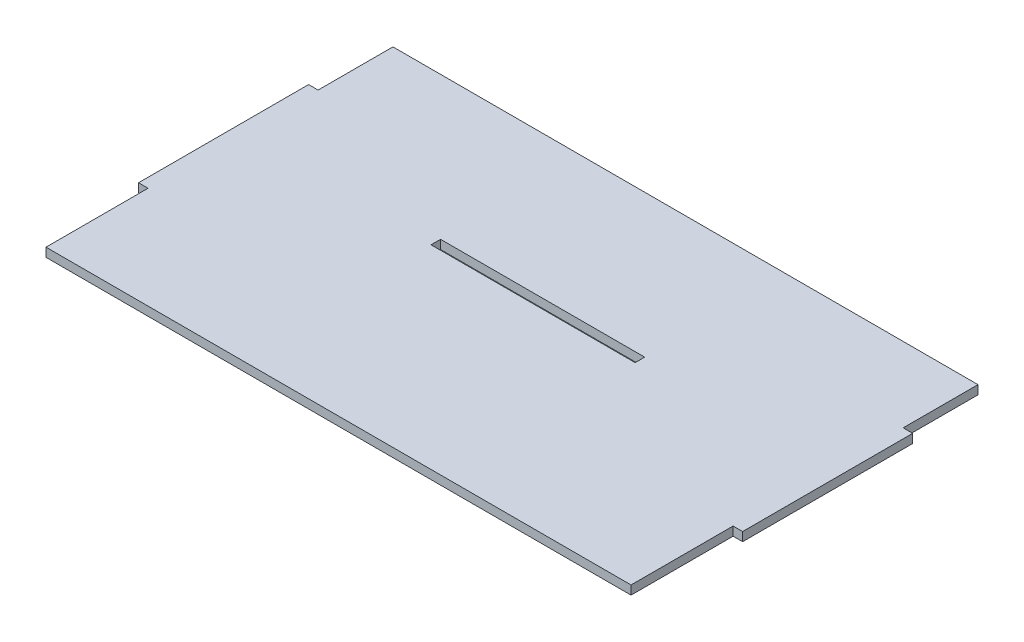
from build123d import *

# Parameters (mm, degrees)
SKETCH1_W           = 86
SKETCH1_H           = 50
BOSS_EXTRUDE1_DEPTH = 1.3
SKETCH2_W           = 1.4
SKETCH2_H           = 25
BOSS_EXTRUDE2_DEPTH = 1.3
SKETCH3_W           = 30
SKETCH3_H           = 1.4
CUT_EXTRUDE1_DEPTH  = 51.971070226
SKETCH4_W           = 86
SKETCH4_H           = 1
BOSS_EXTRUDE3_DEPTH = 1.3


with BuildPart() as part:
    # Sketch1 → Boss-Extrude1 (new body)
    with BuildSketch(Plane(origin=(0, 0, 0), x_dir=(1, 0, 0), z_dir=(0, 1, 0))):
        Rectangle(SKETCH1_W, SKETCH1_H)
    extrude(amount=BOSS_EXTRUDE1_DEPTH)

    # Sketch2 → Boss-Extrude2 (add)
    with BuildSketch(Plane(origin=(0, 1.3, 0), x_dir=(1, 0, 0), z_dir=(0, 1, 0))):
        with Locations((-43.7, 2.5)):
            Rectangle(SKETCH2_W, SKETCH2_H)
        with Locations((43.7, 2.5)):
            Rectangle(SKETCH2_W, SKETCH2_H)
    extrude(amount=-BOSS_EXTRUDE2_DEPTH)

    # Sketch3 → Cut-Extrude1 (cut, through all)
    with BuildSketch(Plane(origin=(0, 1.3, 0), x_dir=(1, 0, 0), z_dir=(0, 1, 0))):
        with Locations((0, 4.3)):
            Rectangle(SKETCH3_W, SKETCH3_H)
    extrude(amount=-CUT_EXTRUDE1_DEPTH, mode=Mode.SUBTRACT)

    # Sketch4 → Boss-Extrude3 (add)
    with BuildSketch(Plane(origin=(0, 0, 0), x_dir=(1, 0, 0), z_dir=(0, 1, 0))):
        with Locations((0, 25.5)):
            Rectangle(SKETCH4_W, SKETCH4_H)
    extrude(amount=BOSS_EXTRUDE3_DEPTH)


solid = part.part
